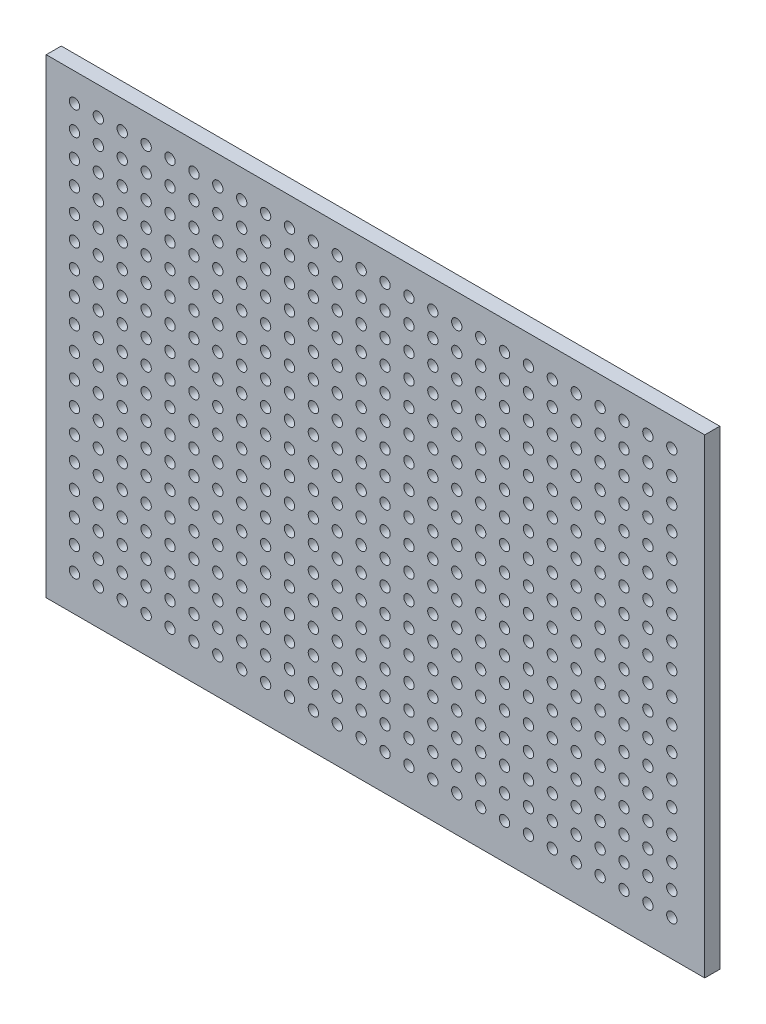
from build123d import *

# Parameters (mm, degrees)
SKETCH1_W           = 70
SKETCH1_H           = 50
BOSS_EXTRUDE1_DEPTH = 1.6
SKETCH2_R           = 0.55
CUT_EXTRUDE2_DEPTH  = 44.041375443


with BuildPart() as part:
    # Sketch1 → Boss-Extrude1 (new body)
    with BuildSketch(Plane.XY):
        Rectangle(SKETCH1_W, SKETCH1_H)
    extrude(amount=BOSS_EXTRUDE1_DEPTH)

    # Sketch2 → Cut-Extrude2 (cut, through all)
    with BuildSketch(Plane.XY.offset(1.6)):
        with Locations((-32, 22)):
            Circle(SKETCH2_R)
        with Locations((-29.46, 22)):
            Circle(SKETCH2_R)
        with Locations((-26.92, 22)):
            Circle(SKETCH2_R)
        with Locations((-24.38, 22)):
            Circle(SKETCH2_R)
        with Locations((-21.84, 22)):
            Circle(SKETCH2_R)
        with Locations((-19.3, 22)):
            Circle(SKETCH2_R)
        with Locations((-16.76, 22)):
            Circle(SKETCH2_R)
        with Locations((-14.22, 22)):
            Circle(SKETCH2_R)
        with Locations((-11.68, 22)):
            Circle(SKETCH2_R)
        with Locations((-9.14, 22)):
            Circle(SKETCH2_R)
        with Locations((-6.6, 22)):
            Circle(SKETCH2_R)
        with Locations((-4.06, 22)):
            Circle(SKETCH2_R)
        with Locations((-1.52, 22)):
            Circle(SKETCH2_R)
        with Locations((1.02, 22)):
            Circle(SKETCH2_R)
        with Locations((3.56, 22)):
            Circle(SKETCH2_R)
        with Locations((6.1, 22)):
            Circle(SKETCH2_R)
        with Locations((8.64, 22)):
            Circle(SKETCH2_R)
        with Locations((11.18, 22)):
            Circle(SKETCH2_R)
        with Locations((13.72, 22)):
            Circle(SKETCH2_R)
        with Locations((16.26, 22)):
            Circle(SKETCH2_R)
        with Locations((18.8, 22)):
            Circle(SKETCH2_R)
        with Locations((21.34, 22)):
            Circle(SKETCH2_R)
        with Locations((23.88, 22)):
            Circle(SKETCH2_R)
        with Locations((26.42, 22)):
            Circle(SKETCH2_R)
        with Locations((28.96, 22)):
            Circle(SKETCH2_R)
        with Locations((31.5, 22)):
            Circle(SKETCH2_R)
        with Locations((-29.46, 19.46)):
            Circle(SKETCH2_R)
        with Locations((-26.92, 19.46)):
            Circle(SKETCH2_R)
        with Locations((-24.38, 19.46)):
            Circle(SKETCH2_R)
        with Locations((-21.84, 19.46)):
            Circle(SKETCH2_R)
        with Locations((-19.3, 19.46)):
            Circle(SKETCH2_R)
        with Locations((-16.76, 19.46)):
            Circle(SKETCH2_R)
        with Locations((-14.22, 19.46)):
            Circle(SKETCH2_R)
        with Locations((-11.68, 19.46)):
            Circle(SKETCH2_R)
        with Locations((-9.14, 19.46)):
            Circle(SKETCH2_R)
        with Locations((-6.6, 19.46)):
            Circle(SKETCH2_R)
        with Locations((-4.06, 19.46)):
            Circle(SKETCH2_R)
        with Locations((-1.52, 19.46)):
            Circle(SKETCH2_R)
        with Locations((1.02, 19.46)):
            Circle(SKETCH2_R)
        with Locations((3.56, 19.46)):
            Circle(SKETCH2_R)
        with Locations((6.1, 19.46)):
            Circle(SKETCH2_R)
        with Locations((8.64, 19.46)):
            Circle(SKETCH2_R)
        with Locations((11.18, 19.46)):
            Circle(SKETCH2_R)
        with Locations((13.72, 19.46)):
            Circle(SKETCH2_R)
        with Locations((16.26, 19.46)):
            Circle(SKETCH2_R)
        with Locations((18.8, 19.46)):
            Circle(SKETCH2_R)
        with Locations((21.34, 19.46)):
            Circle(SKETCH2_R)
        with Locations((23.88, 19.46)):
            Circle(SKETCH2_R)
        with Locations((26.42, 19.46)):
            Circle(SKETCH2_R)
        with Locations((28.96, 19.46)):
            Circle(SKETCH2_R)
        with Locations((31.5, 19.46)):
            Circle(SKETCH2_R)
        with Locations((-29.46, 16.92)):
            Circle(SKETCH2_R)
        with Locations((-26.92, 16.92)):
            Circle(SKETCH2_R)
        with Locations((-24.38, 16.92)):
            Circle(SKETCH2_R)
        with Locations((-21.84, 16.92)):
            Circle(SKETCH2_R)
        with Locations((-19.3, 16.92)):
            Circle(SKETCH2_R)
        with Locations((-16.76, 16.92)):
            Circle(SKETCH2_R)
        with Locations((-14.22, 16.92)):
            Circle(SKETCH2_R)
        with Locations((-11.68, 16.92)):
            Circle(SKETCH2_R)
        with Locations((-9.14, 16.92)):
            Circle(SKETCH2_R)
        with Locations((-6.6, 16.92)):
            Circle(SKETCH2_R)
        with Locations((-4.06, 16.92)):
            Circle(SKETCH2_R)
        with Locations((-1.52, 16.92)):
            Circle(SKETCH2_R)
        with Locations((1.02, 16.92)):
            Circle(SKETCH2_R)
        with Locations((3.56, 16.92)):
            Circle(SKETCH2_R)
        with Locations((6.1, 16.92)):
            Circle(SKETCH2_R)
        with Locations((8.64, 16.92)):
            Circle(SKETCH2_R)
        with Locations((11.18, 16.92)):
            Circle(SKETCH2_R)
        with Locations((13.72, 16.92)):
            Circle(SKETCH2_R)
        with Locations((16.26, 16.92)):
            Circle(SKETCH2_R)
        with Locations((18.8, 16.92)):
            Circle(SKETCH2_R)
        with Locations((21.34, 16.92)):
            Circle(SKETCH2_R)
        with Locations((23.88, 16.92)):
            Circle(SKETCH2_R)
        with Locations((26.42, 16.92)):
            Circle(SKETCH2_R)
        with Locations((28.96, 16.92)):
            Circle(SKETCH2_R)
        with Locations((31.5, 16.92)):
            Circle(SKETCH2_R)
        with Locations((-29.46, 14.38)):
            Circle(SKETCH2_R)
        with Locations((-26.92, 14.38)):
            Circle(SKETCH2_R)
        with Locations((-24.38, 14.38)):
            Circle(SKETCH2_R)
        with Locations((-21.84, 14.38)):
            Circle(SKETCH2_R)
        with Locations((-19.3, 14.38)):
            Circle(SKETCH2_R)
        with Locations((-16.76, 14.38)):
            Circle(SKETCH2_R)
        with Locations((-14.22, 14.38)):
            Circle(SKETCH2_R)
        with Locations((-11.68, 14.38)):
            Circle(SKETCH2_R)
        with Locations((-9.14, 14.38)):
            Circle(SKETCH2_R)
        with Locations((-6.6, 14.38)):
            Circle(SKETCH2_R)
        with Locations((-4.06, 14.38)):
            Circle(SKETCH2_R)
        with Locations((-1.52, 14.38)):
            Circle(SKETCH2_R)
        with Locations((1.02, 14.38)):
            Circle(SKETCH2_R)
        with Locations((3.56, 14.38)):
            Circle(SKETCH2_R)
        with Locations((6.1, 14.38)):
            Circle(SKETCH2_R)
        with Locations((8.64, 14.38)):
            Circle(SKETCH2_R)
        with Locations((11.18, 14.38)):
            Circle(SKETCH2_R)
        with Locations((13.72, 14.38)):
            Circle(SKETCH2_R)
        with Locations((16.26, 14.38)):
            Circle(SKETCH2_R)
        with Locations((18.8, 14.38)):
            Circle(SKETCH2_R)
        with Locations((21.34, 14.38)):
            Circle(SKETCH2_R)
        with Locations((23.88, 14.38)):
            Circle(SKETCH2_R)
        with Locations((26.42, 14.38)):
            Circle(SKETCH2_R)
        with Locations((28.96, 14.38)):
            Circle(SKETCH2_R)
        with Locations((31.5, 14.38)):
            Circle(SKETCH2_R)
        with Locations((-29.46, 11.84)):
            Circle(SKETCH2_R)
        with Locations((-26.92, 11.84)):
            Circle(SKETCH2_R)
        with Locations((-24.38, 11.84)):
            Circle(SKETCH2_R)
        with Locations((-21.84, 11.84)):
            Circle(SKETCH2_R)
        with Locations((-19.3, 11.84)):
            Circle(SKETCH2_R)
        with Locations((-16.76, 11.84)):
            Circle(SKETCH2_R)
        with Locations((-14.22, 11.84)):
            Circle(SKETCH2_R)
        with Locations((-11.68, 11.84)):
            Circle(SKETCH2_R)
        with Locations((-9.14, 11.84)):
            Circle(SKETCH2_R)
        with Locations((-6.6, 11.84)):
            Circle(SKETCH2_R)
        with Locations((-4.06, 11.84)):
            Circle(SKETCH2_R)
        with Locations((-1.52, 11.84)):
            Circle(SKETCH2_R)
        with Locations((1.02, 11.84)):
            Circle(SKETCH2_R)
        with Locations((3.56, 11.84)):
            Circle(SKETCH2_R)
        with Locations((6.1, 11.84)):
            Circle(SKETCH2_R)
        with Locations((8.64, 11.84)):
            Circle(SKETCH2_R)
        with Locations((11.18, 11.84)):
            Circle(SKETCH2_R)
        with Locations((13.72, 11.84)):
            Circle(SKETCH2_R)
        with Locations((16.26, 11.84)):
            Circle(SKETCH2_R)
        with Locations((18.8, 11.84)):
            Circle(SKETCH2_R)
        with Locations((21.34, 11.84)):
            Circle(SKETCH2_R)
        with Locations((23.88, 11.84)):
            Circle(SKETCH2_R)
        with Locations((26.42, 11.84)):
            Circle(SKETCH2_R)
        with Locations((28.96, 11.84)):
            Circle(SKETCH2_R)
        with Locations((31.5, 11.84)):
            Circle(SKETCH2_R)
        with Locations((-29.46, 9.3)):
            Circle(SKETCH2_R)
        with Locations((-26.92, 9.3)):
            Circle(SKETCH2_R)
        with Locations((-24.38, 9.3)):
            Circle(SKETCH2_R)
        with Locations((-21.84, 9.3)):
            Circle(SKETCH2_R)
        with Locations((-19.3, 9.3)):
            Circle(SKETCH2_R)
        with Locations((-16.76, 9.3)):
            Circle(SKETCH2_R)
        with Locations((-14.22, 9.3)):
            Circle(SKETCH2_R)
        with Locations((-11.68, 9.3)):
            Circle(SKETCH2_R)
        with Locations((-9.14, 9.3)):
            Circle(SKETCH2_R)
        with Locations((-6.6, 9.3)):
            Circle(SKETCH2_R)
        with Locations((-4.06, 9.3)):
            Circle(SKETCH2_R)
        with Locations((-1.52, 9.3)):
            Circle(SKETCH2_R)
        with Locations((1.02, 9.3)):
            Circle(SKETCH2_R)
        with Locations((3.56, 9.3)):
            Circle(SKETCH2_R)
        with Locations((6.1, 9.3)):
            Circle(SKETCH2_R)
        with Locations((8.64, 9.3)):
            Circle(SKETCH2_R)
        with Locations((11.18, 9.3)):
            Circle(SKETCH2_R)
        with Locations((13.72, 9.3)):
            Circle(SKETCH2_R)
        with Locations((16.26, 9.3)):
            Circle(SKETCH2_R)
        with Locations((18.8, 9.3)):
            Circle(SKETCH2_R)
        with Locations((21.34, 9.3)):
            Circle(SKETCH2_R)
        with Locations((23.88, 9.3)):
            Circle(SKETCH2_R)
        with Locations((26.42, 9.3)):
            Circle(SKETCH2_R)
        with Locations((28.96, 9.3)):
            Circle(SKETCH2_R)
        with Locations((31.5, 9.3)):
            Circle(SKETCH2_R)
        with Locations((-29.46, 6.76)):
            Circle(SKETCH2_R)
        with Locations((-26.92, 6.76)):
            Circle(SKETCH2_R)
        with Locations((-24.38, 6.76)):
            Circle(SKETCH2_R)
        with Locations((-21.84, 6.76)):
            Circle(SKETCH2_R)
        with Locations((-19.3, 6.76)):
            Circle(SKETCH2_R)
        with Locations((-16.76, 6.76)):
            Circle(SKETCH2_R)
        with Locations((-14.22, 6.76)):
            Circle(SKETCH2_R)
        with Locations((-11.68, 6.76)):
            Circle(SKETCH2_R)
        with Locations((-9.14, 6.76)):
            Circle(SKETCH2_R)
        with Locations((-6.6, 6.76)):
            Circle(SKETCH2_R)
        with Locations((-4.06, 6.76)):
            Circle(SKETCH2_R)
        with Locations((-1.52, 6.76)):
            Circle(SKETCH2_R)
        with Locations((1.02, 6.76)):
            Circle(SKETCH2_R)
        with Locations((3.56, 6.76)):
            Circle(SKETCH2_R)
        with Locations((6.1, 6.76)):
            Circle(SKETCH2_R)
        with Locations((8.64, 6.76)):
            Circle(SKETCH2_R)
        with Locations((11.18, 6.76)):
            Circle(SKETCH2_R)
        with Locations((13.72, 6.76)):
            Circle(SKETCH2_R)
        with Locations((16.26, 6.76)):
            Circle(SKETCH2_R)
        with Locations((18.8, 6.76)):
            Circle(SKETCH2_R)
        with Locations((21.34, 6.76)):
            Circle(SKETCH2_R)
        with Locations((23.88, 6.76)):
            Circle(SKETCH2_R)
        with Locations((26.42, 6.76)):
            Circle(SKETCH2_R)
        with Locations((28.96, 6.76)):
            Circle(SKETCH2_R)
        with Locations((31.5, 6.76)):
            Circle(SKETCH2_R)
        with Locations((-29.46, 4.22)):
            Circle(SKETCH2_R)
        with Locations((-26.92, 4.22)):
            Circle(SKETCH2_R)
        with Locations((-24.38, 4.22)):
            Circle(SKETCH2_R)
        with Locations((-21.84, 4.22)):
            Circle(SKETCH2_R)
        with Locations((-19.3, 4.22)):
            Circle(SKETCH2_R)
        with Locations((-16.76, 4.22)):
            Circle(SKETCH2_R)
        with Locations((-14.22, 4.22)):
            Circle(SKETCH2_R)
        with Locations((-11.68, 4.22)):
            Circle(SKETCH2_R)
        with Locations((-9.14, 4.22)):
            Circle(SKETCH2_R)
        with Locations((-6.6, 4.22)):
            Circle(SKETCH2_R)
        with Locations((-4.06, 4.22)):
            Circle(SKETCH2_R)
        with Locations((-1.52, 4.22)):
            Circle(SKETCH2_R)
        with Locations((1.02, 4.22)):
            Circle(SKETCH2_R)
        with Locations((3.56, 4.22)):
            Circle(SKETCH2_R)
        with Locations((6.1, 4.22)):
            Circle(SKETCH2_R)
        with Locations((8.64, 4.22)):
            Circle(SKETCH2_R)
        with Locations((11.18, 4.22)):
            Circle(SKETCH2_R)
        with Locations((13.72, 4.22)):
            Circle(SKETCH2_R)
        with Locations((16.26, 4.22)):
            Circle(SKETCH2_R)
        with Locations((18.8, 4.22)):
            Circle(SKETCH2_R)
        with Locations((21.34, 4.22)):
            Circle(SKETCH2_R)
        with Locations((23.88, 4.22)):
            Circle(SKETCH2_R)
        with Locations((26.42, 4.22)):
            Circle(SKETCH2_R)
        with Locations((28.96, 4.22)):
            Circle(SKETCH2_R)
        with Locations((31.5, 4.22)):
            Circle(SKETCH2_R)
        with Locations((-29.46, 1.68)):
            Circle(SKETCH2_R)
        with Locations((-26.92, 1.68)):
            Circle(SKETCH2_R)
        with Locations((-24.38, 1.68)):
            Circle(SKETCH2_R)
        with Locations((-21.84, 1.68)):
            Circle(SKETCH2_R)
        with Locations((-19.3, 1.68)):
            Circle(SKETCH2_R)
        with Locations((-16.76, 1.68)):
            Circle(SKETCH2_R)
        with Locations((-14.22, 1.68)):
            Circle(SKETCH2_R)
        with Locations((-11.68, 1.68)):
            Circle(SKETCH2_R)
        with Locations((-9.14, 1.68)):
            Circle(SKETCH2_R)
        with Locations((-6.6, 1.68)):
            Circle(SKETCH2_R)
        with Locations((-4.06, 1.68)):
            Circle(SKETCH2_R)
        with Locations((-1.52, 1.68)):
            Circle(SKETCH2_R)
        with Locations((1.02, 1.68)):
            Circle(SKETCH2_R)
        with Locations((3.56, 1.68)):
            Circle(SKETCH2_R)
        with Locations((6.1, 1.68)):
            Circle(SKETCH2_R)
        with Locations((8.64, 1.68)):
            Circle(SKETCH2_R)
        with Locations((11.18, 1.68)):
            Circle(SKETCH2_R)
        with Locations((13.72, 1.68)):
            Circle(SKETCH2_R)
        with Locations((16.26, 1.68)):
            Circle(SKETCH2_R)
        with Locations((18.8, 1.68)):
            Circle(SKETCH2_R)
        with Locations((21.34, 1.68)):
            Circle(SKETCH2_R)
        with Locations((23.88, 1.68)):
            Circle(SKETCH2_R)
        with Locations((26.42, 1.68)):
            Circle(SKETCH2_R)
        with Locations((28.96, 1.68)):
            Circle(SKETCH2_R)
        with Locations((31.5, 1.68)):
            Circle(SKETCH2_R)
        with Locations((-29.46, -0.86)):
            Circle(SKETCH2_R)
        with Locations((-26.92, -0.86)):
            Circle(SKETCH2_R)
        with Locations((-24.38, -0.86)):
            Circle(SKETCH2_R)
        with Locations((-21.84, -0.86)):
            Circle(SKETCH2_R)
        with Locations((-19.3, -0.86)):
            Circle(SKETCH2_R)
        with Locations((-16.76, -0.86)):
            Circle(SKETCH2_R)
        with Locations((-14.22, -0.86)):
            Circle(SKETCH2_R)
        with Locations((-11.68, -0.86)):
            Circle(SKETCH2_R)
        with Locations((-9.14, -0.86)):
            Circle(SKETCH2_R)
        with Locations((-6.6, -0.86)):
            Circle(SKETCH2_R)
        with Locations((-4.06, -0.86)):
            Circle(SKETCH2_R)
        with Locations((-1.52, -0.86)):
            Circle(SKETCH2_R)
        with Locations((1.02, -0.86)):
            Circle(SKETCH2_R)
        with Locations((3.56, -0.86)):
            Circle(SKETCH2_R)
        with Locations((6.1, -0.86)):
            Circle(SKETCH2_R)
        with Locations((8.64, -0.86)):
            Circle(SKETCH2_R)
        with Locations((11.18, -0.86)):
            Circle(SKETCH2_R)
        with Locations((13.72, -0.86)):
            Circle(SKETCH2_R)
        with Locations((16.26, -0.86)):
            Circle(SKETCH2_R)
        with Locations((18.8, -0.86)):
            Circle(SKETCH2_R)
        with Locations((21.34, -0.86)):
            Circle(SKETCH2_R)
        with Locations((23.88, -0.86)):
            Circle(SKETCH2_R)
        with Locations((26.42, -0.86)):
            Circle(SKETCH2_R)
        with Locations((28.96, -0.86)):
            Circle(SKETCH2_R)
        with Locations((31.5, -0.86)):
            Circle(SKETCH2_R)
        with Locations((-29.46, -3.4)):
            Circle(SKETCH2_R)
        with Locations((-26.92, -3.4)):
            Circle(SKETCH2_R)
        with Locations((-24.38, -3.4)):
            Circle(SKETCH2_R)
        with Locations((-21.84, -3.4)):
            Circle(SKETCH2_R)
        with Locations((-19.3, -3.4)):
            Circle(SKETCH2_R)
        with Locations((-16.76, -3.4)):
            Circle(SKETCH2_R)
        with Locations((-14.22, -3.4)):
            Circle(SKETCH2_R)
        with Locations((-11.68, -3.4)):
            Circle(SKETCH2_R)
        with Locations((-9.14, -3.4)):
            Circle(SKETCH2_R)
        with Locations((-6.6, -3.4)):
            Circle(SKETCH2_R)
        with Locations((-4.06, -3.4)):
            Circle(SKETCH2_R)
        with Locations((-1.52, -3.4)):
            Circle(SKETCH2_R)
        with Locations((1.02, -3.4)):
            Circle(SKETCH2_R)
        with Locations((3.56, -3.4)):
            Circle(SKETCH2_R)
        with Locations((6.1, -3.4)):
            Circle(SKETCH2_R)
        with Locations((8.64, -3.4)):
            Circle(SKETCH2_R)
        with Locations((11.18, -3.4)):
            Circle(SKETCH2_R)
        with Locations((13.72, -3.4)):
            Circle(SKETCH2_R)
        with Locations((16.26, -3.4)):
            Circle(SKETCH2_R)
        with Locations((18.8, -3.4)):
            Circle(SKETCH2_R)
        with Locations((21.34, -3.4)):
            Circle(SKETCH2_R)
        with Locations((23.88, -3.4)):
            Circle(SKETCH2_R)
        with Locations((26.42, -3.4)):
            Circle(SKETCH2_R)
        with Locations((28.96, -3.4)):
            Circle(SKETCH2_R)
        with Locations((31.5, -3.4)):
            Circle(SKETCH2_R)
        with Locations((-29.46, -5.94)):
            Circle(SKETCH2_R)
        with Locations((-26.92, -5.94)):
            Circle(SKETCH2_R)
        with Locations((-24.38, -5.94)):
            Circle(SKETCH2_R)
        with Locations((-21.84, -5.94)):
            Circle(SKETCH2_R)
        with Locations((-19.3, -5.94)):
            Circle(SKETCH2_R)
        with Locations((-16.76, -5.94)):
            Circle(SKETCH2_R)
        with Locations((-14.22, -5.94)):
            Circle(SKETCH2_R)
        with Locations((-11.68, -5.94)):
            Circle(SKETCH2_R)
        with Locations((-9.14, -5.94)):
            Circle(SKETCH2_R)
        with Locations((-6.6, -5.94)):
            Circle(SKETCH2_R)
        with Locations((-4.06, -5.94)):
            Circle(SKETCH2_R)
        with Locations((-1.52, -5.94)):
            Circle(SKETCH2_R)
        with Locations((1.02, -5.94)):
            Circle(SKETCH2_R)
        with Locations((3.56, -5.94)):
            Circle(SKETCH2_R)
        with Locations((6.1, -5.94)):
            Circle(SKETCH2_R)
        with Locations((8.64, -5.94)):
            Circle(SKETCH2_R)
        with Locations((11.18, -5.94)):
            Circle(SKETCH2_R)
        with Locations((13.72, -5.94)):
            Circle(SKETCH2_R)
        with Locations((16.26, -5.94)):
            Circle(SKETCH2_R)
        with Locations((18.8, -5.94)):
            Circle(SKETCH2_R)
        with Locations((21.34, -5.94)):
            Circle(SKETCH2_R)
        with Locations((23.88, -5.94)):
            Circle(SKETCH2_R)
        with Locations((26.42, -5.94)):
            Circle(SKETCH2_R)
        with Locations((28.96, -5.94)):
            Circle(SKETCH2_R)
        with Locations((31.5, -5.94)):
            Circle(SKETCH2_R)
        with Locations((-29.46, -8.48)):
            Circle(SKETCH2_R)
        with Locations((-26.92, -8.48)):
            Circle(SKETCH2_R)
        with Locations((-24.38, -8.48)):
            Circle(SKETCH2_R)
        with Locations((-21.84, -8.48)):
            Circle(SKETCH2_R)
        with Locations((-19.3, -8.48)):
            Circle(SKETCH2_R)
        with Locations((-16.76, -8.48)):
            Circle(SKETCH2_R)
        with Locations((-14.22, -8.48)):
            Circle(SKETCH2_R)
        with Locations((-11.68, -8.48)):
            Circle(SKETCH2_R)
        with Locations((-9.14, -8.48)):
            Circle(SKETCH2_R)
        with Locations((-6.6, -8.48)):
            Circle(SKETCH2_R)
        with Locations((-4.06, -8.48)):
            Circle(SKETCH2_R)
        with Locations((-1.52, -8.48)):
            Circle(SKETCH2_R)
        with Locations((1.02, -8.48)):
            Circle(SKETCH2_R)
        with Locations((3.56, -8.48)):
            Circle(SKETCH2_R)
        with Locations((6.1, -8.48)):
            Circle(SKETCH2_R)
        with Locations((8.64, -8.48)):
            Circle(SKETCH2_R)
        with Locations((11.18, -8.48)):
            Circle(SKETCH2_R)
        with Locations((13.72, -8.48)):
            Circle(SKETCH2_R)
        with Locations((16.26, -8.48)):
            Circle(SKETCH2_R)
        with Locations((18.8, -8.48)):
            Circle(SKETCH2_R)
        with Locations((21.34, -8.48)):
            Circle(SKETCH2_R)
        with Locations((23.88, -8.48)):
            Circle(SKETCH2_R)
        with Locations((26.42, -8.48)):
            Circle(SKETCH2_R)
        with Locations((28.96, -8.48)):
            Circle(SKETCH2_R)
        with Locations((31.5, -8.48)):
            Circle(SKETCH2_R)
        with Locations((-29.46, -11.02)):
            Circle(SKETCH2_R)
        with Locations((-26.92, -11.02)):
            Circle(SKETCH2_R)
        with Locations((-24.38, -11.02)):
            Circle(SKETCH2_R)
        with Locations((-21.84, -11.02)):
            Circle(SKETCH2_R)
        with Locations((-19.3, -11.02)):
            Circle(SKETCH2_R)
        with Locations((-16.76, -11.02)):
            Circle(SKETCH2_R)
        with Locations((-14.22, -11.02)):
            Circle(SKETCH2_R)
        with Locations((-11.68, -11.02)):
            Circle(SKETCH2_R)
        with Locations((-9.14, -11.02)):
            Circle(SKETCH2_R)
        with Locations((-6.6, -11.02)):
            Circle(SKETCH2_R)
        with Locations((-4.06, -11.02)):
            Circle(SKETCH2_R)
        with Locations((-1.52, -11.02)):
            Circle(SKETCH2_R)
        with Locations((1.02, -11.02)):
            Circle(SKETCH2_R)
        with Locations((3.56, -11.02)):
            Circle(SKETCH2_R)
        with Locations((6.1, -11.02)):
            Circle(SKETCH2_R)
        with Locations((8.64, -11.02)):
            Circle(SKETCH2_R)
        with Locations((11.18, -11.02)):
            Circle(SKETCH2_R)
        with Locations((13.72, -11.02)):
            Circle(SKETCH2_R)
        with Locations((16.26, -11.02)):
            Circle(SKETCH2_R)
        with Locations((18.8, -11.02)):
            Circle(SKETCH2_R)
        with Locations((21.34, -11.02)):
            Circle(SKETCH2_R)
        with Locations((23.88, -11.02)):
            Circle(SKETCH2_R)
        with Locations((26.42, -11.02)):
            Circle(SKETCH2_R)
        with Locations((28.96, -11.02)):
            Circle(SKETCH2_R)
        with Locations((31.5, -11.02)):
            Circle(SKETCH2_R)
        with Locations((-29.46, -13.56)):
            Circle(SKETCH2_R)
        with Locations((-26.92, -13.56)):
            Circle(SKETCH2_R)
        with Locations((-24.38, -13.56)):
            Circle(SKETCH2_R)
        with Locations((-21.84, -13.56)):
            Circle(SKETCH2_R)
        with Locations((-19.3, -13.56)):
            Circle(SKETCH2_R)
        with Locations((-16.76, -13.56)):
            Circle(SKETCH2_R)
        with Locations((-14.22, -13.56)):
            Circle(SKETCH2_R)
        with Locations((-11.68, -13.56)):
            Circle(SKETCH2_R)
        with Locations((-9.14, -13.56)):
            Circle(SKETCH2_R)
        with Locations((-6.6, -13.56)):
            Circle(SKETCH2_R)
        with Locations((-4.06, -13.56)):
            Circle(SKETCH2_R)
        with Locations((-1.52, -13.56)):
            Circle(SKETCH2_R)
        with Locations((1.02, -13.56)):
            Circle(SKETCH2_R)
        with Locations((3.56, -13.56)):
            Circle(SKETCH2_R)
        with Locations((6.1, -13.56)):
            Circle(SKETCH2_R)
        with Locations((8.64, -13.56)):
            Circle(SKETCH2_R)
        with Locations((11.18, -13.56)):
            Circle(SKETCH2_R)
        with Locations((13.72, -13.56)):
            Circle(SKETCH2_R)
        with Locations((16.26, -13.56)):
            Circle(SKETCH2_R)
        with Locations((18.8, -13.56)):
            Circle(SKETCH2_R)
        with Locations((21.34, -13.56)):
            Circle(SKETCH2_R)
        with Locations((23.88, -13.56)):
            Circle(SKETCH2_R)
        with Locations((26.42, -13.56)):
            Circle(SKETCH2_R)
        with Locations((28.96, -13.56)):
            Circle(SKETCH2_R)
        with Locations((31.5, -13.56)):
            Circle(SKETCH2_R)
        with Locations((-29.46, -16.1)):
            Circle(SKETCH2_R)
        with Locations((-26.92, -16.1)):
            Circle(SKETCH2_R)
        with Locations((-24.38, -16.1)):
            Circle(SKETCH2_R)
        with Locations((-21.84, -16.1)):
            Circle(SKETCH2_R)
        with Locations((-19.3, -16.1)):
            Circle(SKETCH2_R)
        with Locations((-16.76, -16.1)):
            Circle(SKETCH2_R)
        with Locations((-14.22, -16.1)):
            Circle(SKETCH2_R)
        with Locations((-11.68, -16.1)):
            Circle(SKETCH2_R)
        with Locations((-9.14, -16.1)):
            Circle(SKETCH2_R)
        with Locations((-6.6, -16.1)):
            Circle(SKETCH2_R)
        with Locations((-4.06, -16.1)):
            Circle(SKETCH2_R)
        with Locations((-1.52, -16.1)):
            Circle(SKETCH2_R)
        with Locations((1.02, -16.1)):
            Circle(SKETCH2_R)
        with Locations((3.56, -16.1)):
            Circle(SKETCH2_R)
        with Locations((6.1, -16.1)):
            Circle(SKETCH2_R)
        with Locations((8.64, -16.1)):
            Circle(SKETCH2_R)
        with Locations((11.18, -16.1)):
            Circle(SKETCH2_R)
        with Locations((13.72, -16.1)):
            Circle(SKETCH2_R)
        with Locations((16.26, -16.1)):
            Circle(SKETCH2_R)
        with Locations((18.8, -16.1)):
            Circle(SKETCH2_R)
        with Locations((21.34, -16.1)):
            Circle(SKETCH2_R)
        with Locations((23.88, -16.1)):
            Circle(SKETCH2_R)
        with Locations((26.42, -16.1)):
            Circle(SKETCH2_R)
        with Locations((28.96, -16.1)):
            Circle(SKETCH2_R)
        with Locations((31.5, -16.1)):
            Circle(SKETCH2_R)
        with Locations((-29.46, -18.64)):
            Circle(SKETCH2_R)
        with Locations((-26.92, -18.64)):
            Circle(SKETCH2_R)
        with Locations((-24.38, -18.64)):
            Circle(SKETCH2_R)
        with Locations((-21.84, -18.64)):
            Circle(SKETCH2_R)
        with Locations((-19.3, -18.64)):
            Circle(SKETCH2_R)
        with Locations((-16.76, -18.64)):
            Circle(SKETCH2_R)
        with Locations((-14.22, -18.64)):
            Circle(SKETCH2_R)
        with Locations((-11.68, -18.64)):
            Circle(SKETCH2_R)
        with Locations((-9.14, -18.64)):
            Circle(SKETCH2_R)
        with Locations((-6.6, -18.64)):
            Circle(SKETCH2_R)
        with Locations((-4.06, -18.64)):
            Circle(SKETCH2_R)
        with Locations((-1.52, -18.64)):
            Circle(SKETCH2_R)
        with Locations((1.02, -18.64)):
            Circle(SKETCH2_R)
        with Locations((3.56, -18.64)):
            Circle(SKETCH2_R)
        with Locations((6.1, -18.64)):
            Circle(SKETCH2_R)
        with Locations((8.64, -18.64)):
            Circle(SKETCH2_R)
        with Locations((11.18, -18.64)):
            Circle(SKETCH2_R)
        with Locations((13.72, -18.64)):
            Circle(SKETCH2_R)
        with Locations((16.26, -18.64)):
            Circle(SKETCH2_R)
        with Locations((18.8, -18.64)):
            Circle(SKETCH2_R)
        with Locations((21.34, -18.64)):
            Circle(SKETCH2_R)
        with Locations((23.88, -18.64)):
            Circle(SKETCH2_R)
        with Locations((26.42, -18.64)):
            Circle(SKETCH2_R)
        with Locations((28.96, -18.64)):
            Circle(SKETCH2_R)
        with Locations((31.5, -18.64)):
            Circle(SKETCH2_R)
        with Locations((-29.46, -21.18)):
            Circle(SKETCH2_R)
        with Locations((-26.92, -21.18)):
            Circle(SKETCH2_R)
        with Locations((-24.38, -21.18)):
            Circle(SKETCH2_R)
        with Locations((-21.84, -21.18)):
            Circle(SKETCH2_R)
        with Locations((-19.3, -21.18)):
            Circle(SKETCH2_R)
        with Locations((-16.76, -21.18)):
            Circle(SKETCH2_R)
        with Locations((-14.22, -21.18)):
            Circle(SKETCH2_R)
        with Locations((-11.68, -21.18)):
            Circle(SKETCH2_R)
        with Locations((-9.14, -21.18)):
            Circle(SKETCH2_R)
        with Locations((-6.6, -21.18)):
            Circle(SKETCH2_R)
        with Locations((-4.06, -21.18)):
            Circle(SKETCH2_R)
        with Locations((-1.52, -21.18)):
            Circle(SKETCH2_R)
        with Locations((1.02, -21.18)):
            Circle(SKETCH2_R)
        with Locations((3.56, -21.18)):
            Circle(SKETCH2_R)
        with Locations((6.1, -21.18)):
            Circle(SKETCH2_R)
        with Locations((8.64, -21.18)):
            Circle(SKETCH2_R)
        with Locations((11.18, -21.18)):
            Circle(SKETCH2_R)
        with Locations((13.72, -21.18)):
            Circle(SKETCH2_R)
        with Locations((16.26, -21.18)):
            Circle(SKETCH2_R)
        with Locations((18.8, -21.18)):
            Circle(SKETCH2_R)
        with Locations((21.34, -21.18)):
            Circle(SKETCH2_R)
        with Locations((23.88, -21.18)):
            Circle(SKETCH2_R)
        with Locations((26.42, -21.18)):
            Circle(SKETCH2_R)
        with Locations((28.96, -21.18)):
            Circle(SKETCH2_R)
        with Locations((31.5, -21.18)):
            Circle(SKETCH2_R)
        with Locations((-32, 19.46)):
            Circle(SKETCH2_R)
        with Locations((-32, 16.92)):
            Circle(SKETCH2_R)
        with Locations((-32, 14.38)):
            Circle(SKETCH2_R)
        with Locations((-32, 11.84)):
            Circle(SKETCH2_R)
        with Locations((-32, 9.3)):
            Circle(SKETCH2_R)
        with Locations((-32, 6.76)):
            Circle(SKETCH2_R)
        with Locations((-32, 4.22)):
            Circle(SKETCH2_R)
        with Locations((-32, 1.68)):
            Circle(SKETCH2_R)
        with Locations((-32, -0.86)):
            Circle(SKETCH2_R)
        with Locations((-32, -3.4)):
            Circle(SKETCH2_R)
        with Locations((-32, -5.94)):
            Circle(SKETCH2_R)
        with Locations((-32, -8.48)):
            Circle(SKETCH2_R)
        with Locations((-32, -11.02)):
            Circle(SKETCH2_R)
        with Locations((-32, -13.56)):
            Circle(SKETCH2_R)
        with Locations((-32, -16.1)):
            Circle(SKETCH2_R)
        with Locations((-32, -18.64)):
            Circle(SKETCH2_R)
        with Locations((-32, -21.18)):
            Circle(SKETCH2_R)
    extrude(amount=-CUT_EXTRUDE2_DEPTH, mode=Mode.SUBTRACT)


solid = part.part
